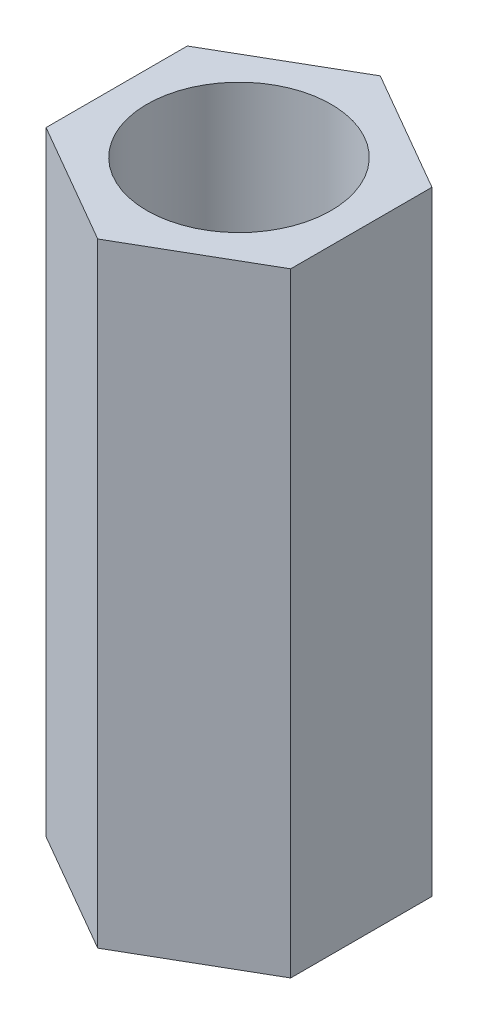
from build123d import *

# Parameters (mm, degrees)
SKETCH_1_R      = 1.5
EXTRUDE_1_DEPTH = 10


with BuildPart() as part:
    # 草图1 → 凸台-拉伸1 (new body)
    with BuildSketch(Plane(origin=(0, 0, 0), x_dir=(1, 0, 0), z_dir=(0, 1, 0))):
        Polygon((1.991858429, 1.15), (0, 2.3), (-1.991858429, 1.15), (-1.991858429, -1.15), (0, -2.3), (1.991858429, -1.15), align=None)
        with Locations(Location((0, 0, 0), (0, 0, 270))):
            Circle(SKETCH_1_R, mode=Mode.SUBTRACT)
    extrude(amount=EXTRUDE_1_DEPTH)


solid = part.part
